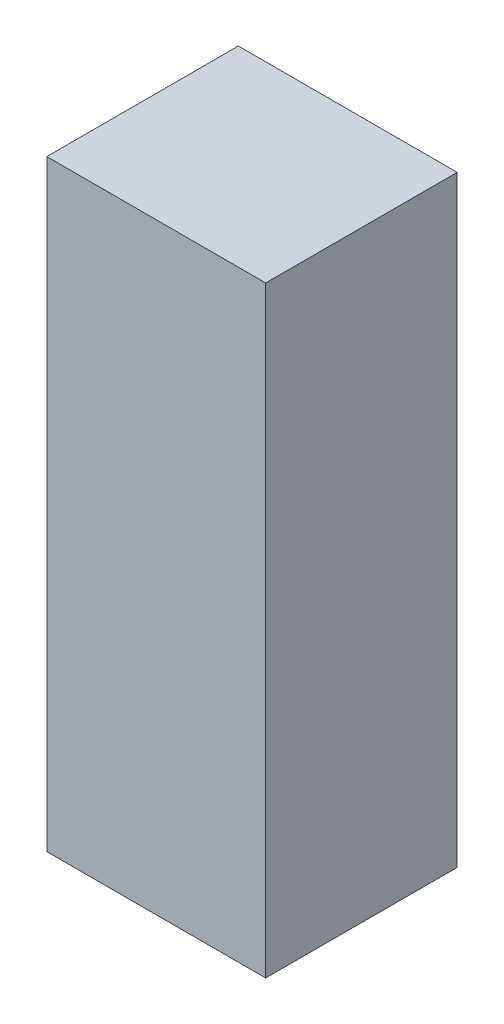
from build123d import *

# Parameters (mm, degrees)
SKETCH_1_W      = 40
SKETCH_1_H      = 35
EXTRUDE_1_DEPTH = 110


with BuildPart() as part:
    # 草图1 → 凸台-拉伸1 (new body)
    with BuildSketch(Plane(origin=(0, 0, 0), x_dir=(1, 0, 0), z_dir=(0, 1, 0))):
        Rectangle(SKETCH_1_W, SKETCH_1_H)
    extrude(amount=EXTRUDE_1_DEPTH)


solid = part.part
